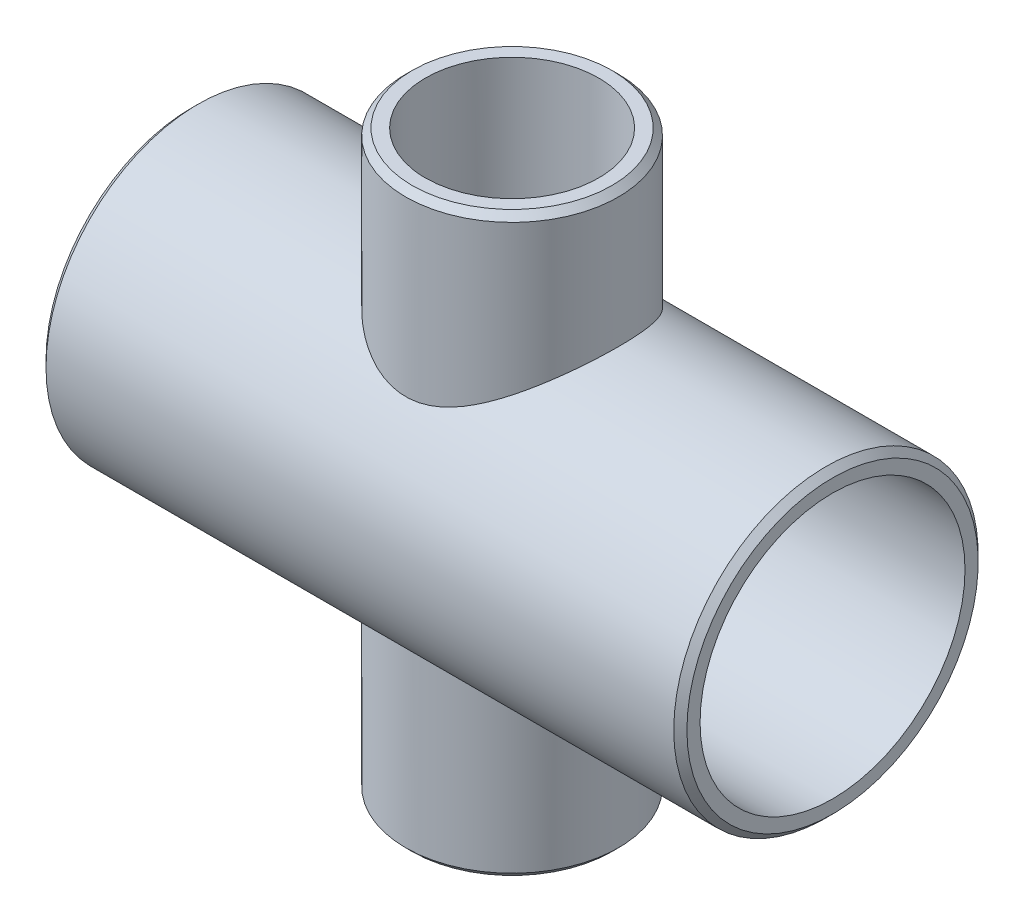
from build123d import *

# Parameters (mm, degrees)
RUNROUTE_R          = 30.1625
RUNEXTRUDE_DEPTH    = 63.5
OUTLETROUTE_R       = 21.082
OUTLETEXTRUDE_DEPTH = 57.15
CROSSSHELL_T        = -3.9116
CROSSCHAMFER_SIZE   = 1.303866667


with BuildPart() as part:
    # RunRoute → RunExtrude (new body)
    with BuildSketch(Plane(origin=(0, 0, 0), x_dir=(0, 0, -1), z_dir=(1, 0, 0))):
        Circle(RUNROUTE_R)
    runextrude = extrude(amount=RUNEXTRUDE_DEPTH)

    # RunExtrudeMirror: RunExtrude across plane
    add(runextrude.mirror(Plane(origin=(0, 0, 0), x_dir=(0, 0, 1), z_dir=(1, 0, 0))))

    # OutletRoute → OutletExtrude (add)
    with BuildSketch(Plane(origin=(0, 0, 0), x_dir=(1, 0, 0), z_dir=(0, 1, 0))):
        with Locations(Location((0, 0, 0), (0, 0, 90))):
            Circle(OUTLETROUTE_R)
    outletextrude = extrude(amount=OUTLETEXTRUDE_DEPTH)

    # OutletExtrudeMirror: OutletExtrude across plane
    add(outletextrude.mirror(Plane.ZX))

    # CrossShell
    crossshell_openings = [part.faces().sort_by_distance(p)[0] for p in [
        (63.5, 0, 0),
        (0, 57.15, 0),
        (0, -57.15, 0),
        (-63.5, 0, 0),
    ]]
    offset(amount=CROSSSHELL_T, openings=crossshell_openings, kind=Kind.INTERSECTION)

    # CrossChamfer
    crosschamfer_edges = [part.edges().sort_by_distance(p)[0] for p in [
        (0, -57.15, 21.082),
        (63.5, 0, 30.1625),
        (-63.5, 0, 30.1625),
        (0, 57.15, 21.082),
    ]]
    chamfer(crosschamfer_edges, length=CROSSCHAMFER_SIZE)


solid = part.part
